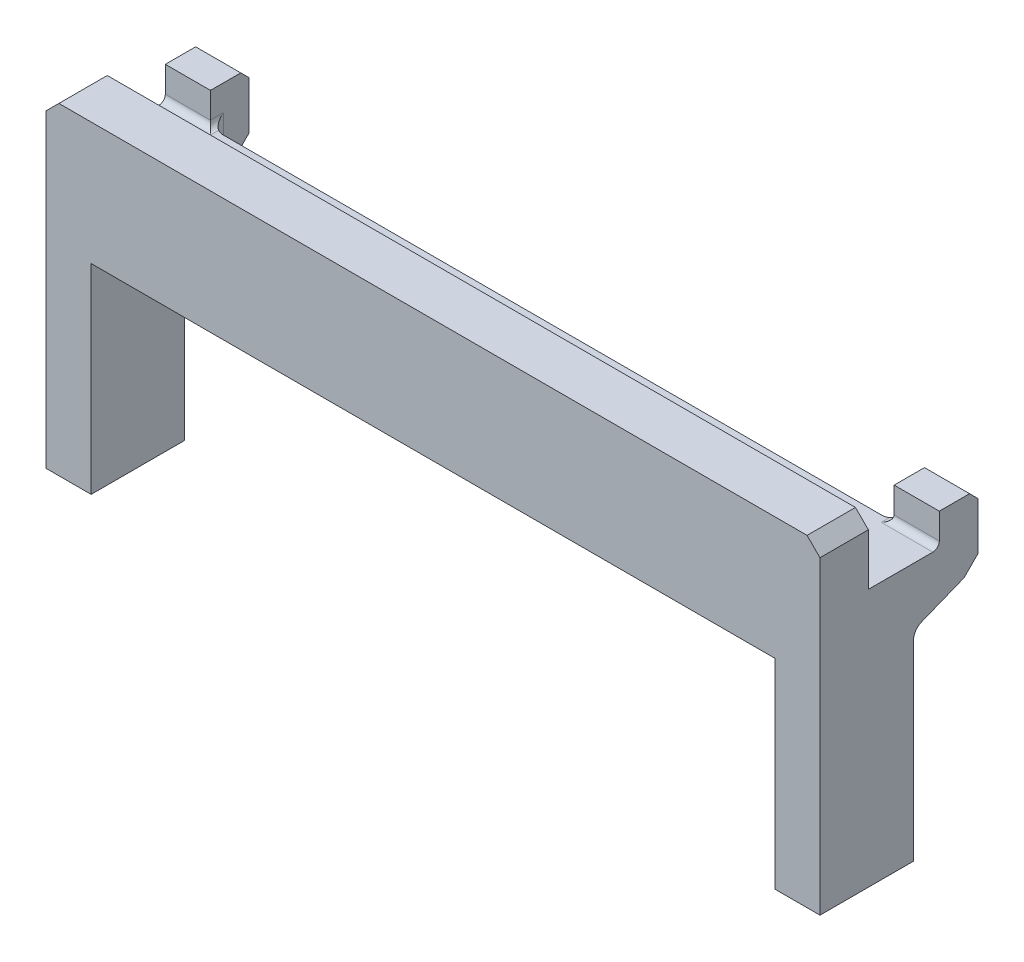
from build123d import *
from OCP.BRepFilletAPI import BRepFilletAPI_MakeChamfer

# Parameters (mm, degrees)
BOSS_EXTRUDE1_DEPTH = 76.2
BOSS_EXTRUDE3_DEPTH = 152.4
SKETCH2_W           = 134.62
SKETCH2_H           = 39.37
CUT_EXTRUDE1_DEPTH  = 94.414090077
CHAMFER1_SIZE       = 2.54
SKETCH5_W           = 7.62
SKETCH5_H           = 6.35
BOSS_EXTRUDE4_DEPTH = 8.89
SKETCH6_W           = 134.62
SKETCH6_H           = 7.62
CUT_EXTRUDE2_DEPTH  = 95.091487925
FILLET1_R           = 2.54
FILLET2_R           = 1.27
CHAMFER2_SIZE       = 1.651
CHAMFER2_SIZE2      = 2.963635699


with BuildPart() as part:
    # Sketch1 → Boss-Extrude1 (new, symmetric)
    with BuildSketch(Plane(origin=(0, 0, 0), x_dir=(0, 0, -1), z_dir=(1, 0, 0))):
        Polygon((0, 0), (0, 12.7), (-9.525, 12.7), (-9.525, -50.8), (8.89, -50.8), (8.89, 0), align=None)
    extrude(amount=BOSS_EXTRUDE1_DEPTH, both=True)

    # Sketch4 → Boss-Extrude3 (add)
    with BuildSketch(Plane(origin=(76.2, 0, 0), x_dir=(0, 0, -1), z_dir=(1, 0, 0))):
        Polygon((8.89, 0), (21.59, 0), (21.59, -6.35), (8.89, -11.43), align=None)
    extrude(amount=-BOSS_EXTRUDE3_DEPTH)

    # Sketch2 → Cut-Extrude1 (cut, through all)
    with BuildSketch(Plane(origin=(0, 0, -8.89), x_dir=(-1, 0, 0), z_dir=(0, 0, -1))):
        with Locations((0, -31.115)):
            Rectangle(SKETCH2_W, SKETCH2_H)
    extrude(amount=-CUT_EXTRUDE1_DEPTH, mode=Mode.SUBTRACT)

    # Chamfer1
    chamfer1_edges = [part.edges().sort_by_distance(p)[0] for p in [
        (76.2, 12.7, 4.7625),
        (-76.2, 12.7, 4.7625),
    ]]
    chamfer(chamfer1_edges, length=CHAMFER1_SIZE)

    # Sketch5 → Boss-Extrude4 (add)
    with BuildSketch(Plane(origin=(76.2, 0, 0), x_dir=(0, 0, -1), z_dir=(1, 0, 0))):
        with Locations((17.78, 3.175)):
            Rectangle(SKETCH5_W, SKETCH5_H)
    boss_extrude4 = extrude(amount=-BOSS_EXTRUDE4_DEPTH)

    # Mirror1: Boss-Extrude4 across plane
    add(boss_extrude4.mirror(Plane(origin=(0, 0, 0), x_dir=(0, 0, 1), z_dir=(1, 0, 0))))

    # Sketch6 → Cut-Extrude2 (cut, through all)
    with BuildSketch(Plane(origin=(0, 0, 0), x_dir=(1, 0, 0), z_dir=(0, 1, 0))):
        with Locations((0, 17.78)):
            Rectangle(SKETCH6_W, SKETCH6_H)
    extrude(amount=-CUT_EXTRUDE2_DEPTH, mode=Mode.SUBTRACT)

    # Fillet1
    fillet1_edges = [part.edges().sort_by_distance(p)[0] for p in [
        (-71.755, -11.43, -8.89),
        (71.755, -11.43, -8.89),
        (-67.31, -4.699, -13.97),
        (67.31, -4.699, -13.97),
    ]]
    fillet(fillet1_edges, radius=FILLET1_R)

    # Fillet2
    fillet2_edges = [part.edges().sort_by_distance(p)[0] for p in [
        (67.31, 0, -15.24),
        (-67.31, 0, -15.24),
        (71.755, 0, -13.97),
        (-71.755, 0, -13.97),
    ]]
    fillet(fillet2_edges, radius=FILLET2_R)

    # Chamfer2: one chamfer whose edges measure the first distance from different faces: ONE call of the kernel's chamfer builder (chamfer() names one face for all edges)
    chamfer2_edges_1 = [part.edges().sort_by_distance(p)[0] for p in [
        (-71.755, -6.35, -21.59),
    ]]
    chamfer2_side_1 = [part.faces().sort_by_distance(p)[0] for p in [
        (-71.755, 0, -21.59),
    ]]
    chamfer2_edges_2 = [part.edges().sort_by_distance(p)[0] for p in [
        (71.755, 6.35, -21.59),
        (-71.755, 6.35, -21.59),
    ]]
    chamfer2_edges_3 = [part.edges().sort_by_distance(p)[0] for p in [
        (71.755, -6.35, -21.59),
    ]]
    chamfer2_side_3 = [part.faces().sort_by_distance(p)[0] for p in [
        (71.755, 0, -21.59),
    ]]
    chamfer2 = BRepFilletAPI_MakeChamfer(part.part.solid().wrapped)
    for e in chamfer2_edges_1:
        chamfer2.Add(CHAMFER2_SIZE, CHAMFER2_SIZE2, e.wrapped, chamfer2_side_1[0].wrapped)  # the first distance lies on this face
    for e in chamfer2_edges_2:
        chamfer2.Add(CHAMFER2_SIZE, e.wrapped)
    for e in chamfer2_edges_3:
        chamfer2.Add(CHAMFER2_SIZE, CHAMFER2_SIZE2, e.wrapped, chamfer2_side_3[0].wrapped)  # the first distance lies on this face
    add(Compound.cast(chamfer2.Shape()), mode=Mode.REPLACE)


solid = part.part
